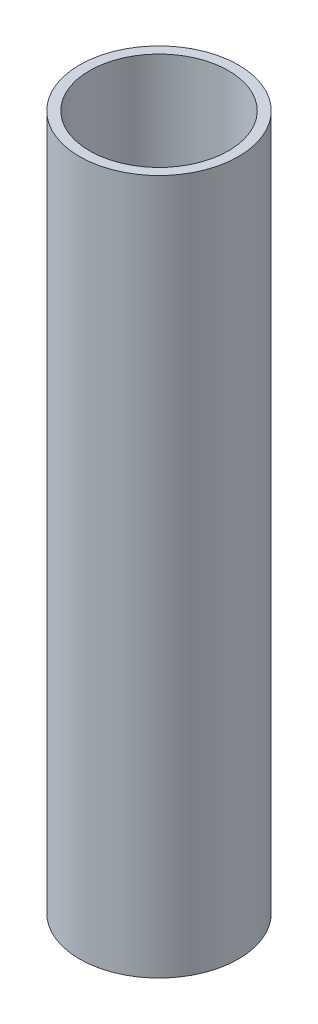
from build123d import *

# Parameters (mm, degrees)
CROQUIS1_R              = 4
CROQUIS1_R_2            = 3.5
SALIENTE_EXTRUIR1_DEPTH = 35


with BuildPart() as part:
    # Croquis1 → Saliente-Extruir1 (new body)
    with BuildSketch(Plane(origin=(0, 0, 0), x_dir=(1, 0, 0), z_dir=(0, 1, 0))):
        with Locations(Location((0, 0, 0), (0, 0, 270))):
            Circle(CROQUIS1_R)
        with Locations(Location((0, 0, 0), (0, 0, 270))):
            Circle(CROQUIS1_R_2, mode=Mode.SUBTRACT)
    extrude(amount=SALIENTE_EXTRUIR1_DEPTH)


solid = part.part
